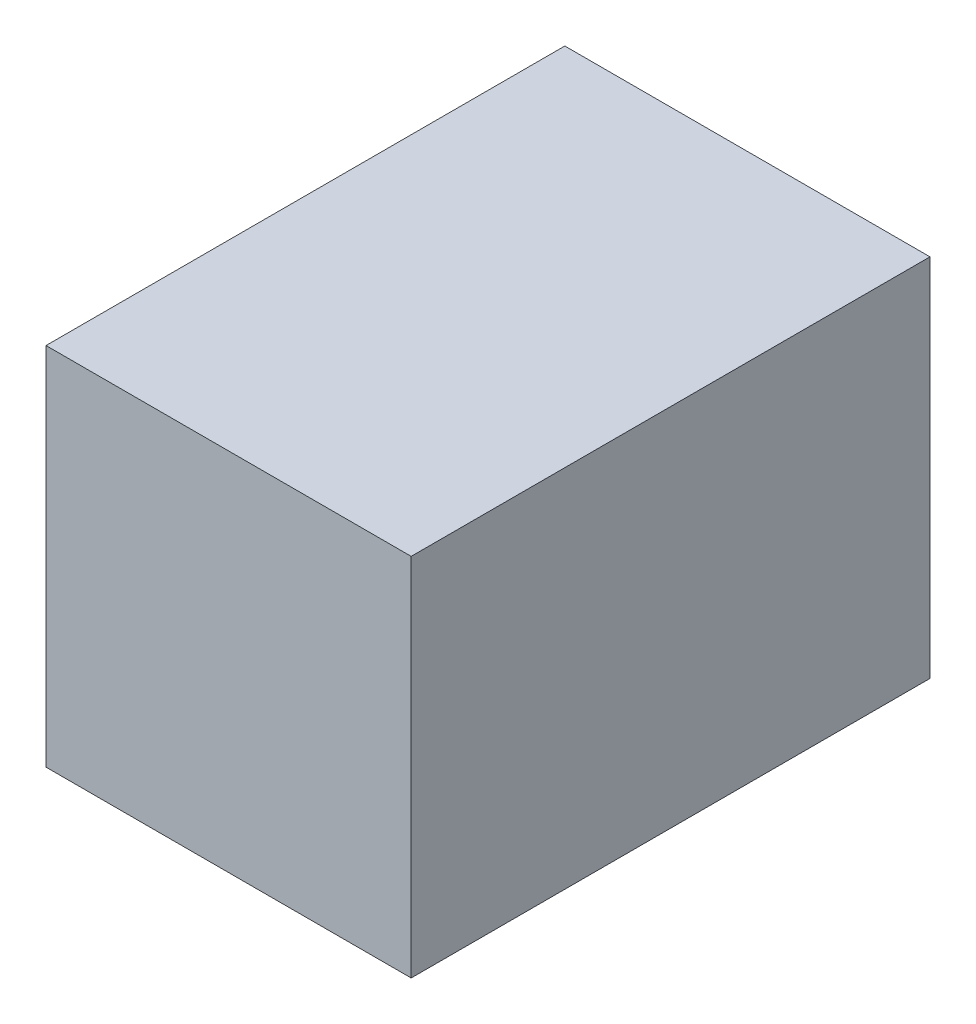
from build123d import *

# Parameters (mm, degrees)
SKETCH1_W           = 20
SKETCH1_H           = 20
BOSS_EXTRUDE1_DEPTH = 28.414709848


with BuildPart() as part:
    # Sketch1 → Boss-Extrude1 (new body)
    with BuildSketch(Plane.XY):
        with Locations((10, 10)):
            Rectangle(SKETCH1_W, SKETCH1_H)
    extrude(amount=BOSS_EXTRUDE1_DEPTH)


solid = part.part
